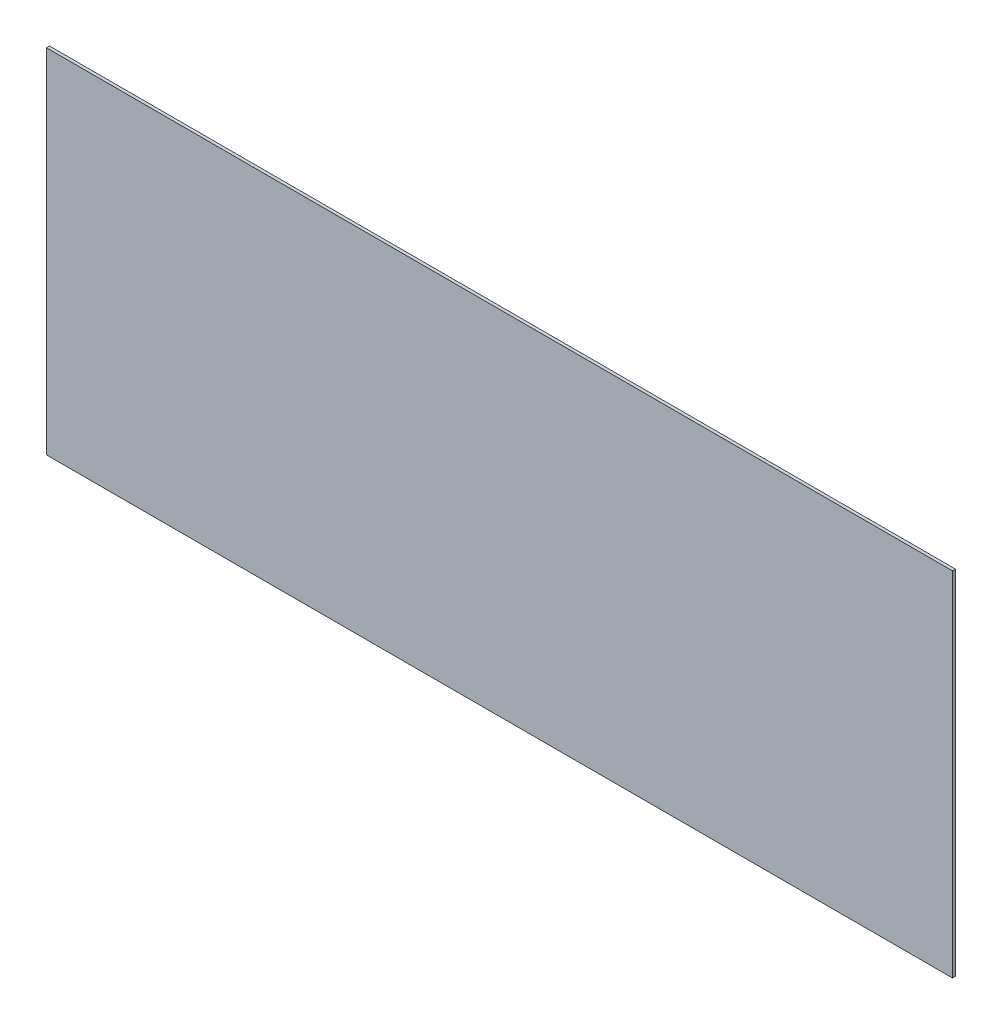
from build123d import *

# Parameters (mm, degrees)
SKETCH2_W           = 949.53
SKETCH2_H           = 369.53
BOSS_EXTRUDE1_DEPTH = 3.175


with BuildPart() as part:
    # Sketch2 → Boss-Extrude1 (new body)
    with BuildSketch(Plane.XY):
        Rectangle(SKETCH2_W, SKETCH2_H)
    extrude(amount=BOSS_EXTRUDE1_DEPTH)


solid = part.part
